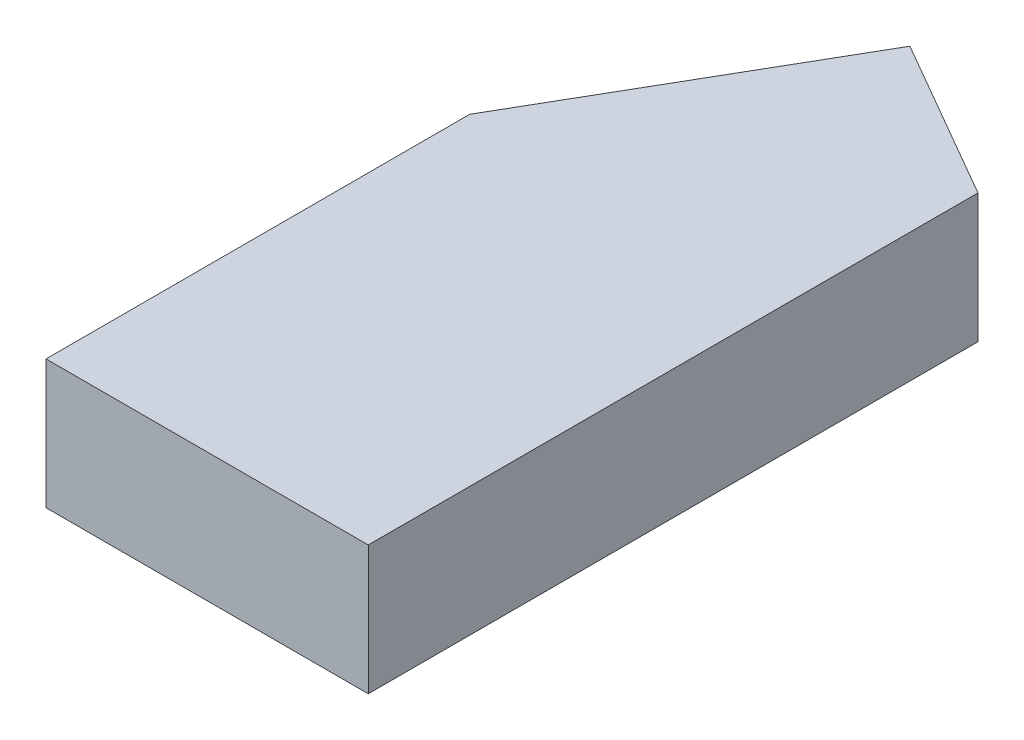
from build123d import *

# Parameters (mm, degrees)
BOSS_EXTRUDE1_DEPTH = 10


with BuildPart() as part:
    # Sketch1 → Boss-Extrude1 (new body)
    with BuildSketch(Plane(origin=(0, 0, 0), x_dir=(1, 0, 0), z_dir=(0, 1, 0))):
        Polygon((59.961524227, -12.685045424), (59.961524227, 34.618802154), (47.461524227, 41.835680518), (34.961524227, 20.185045424), (34.961524227, -12.685045424), align=None)
    extrude(amount=BOSS_EXTRUDE1_DEPTH)


solid = part.part
